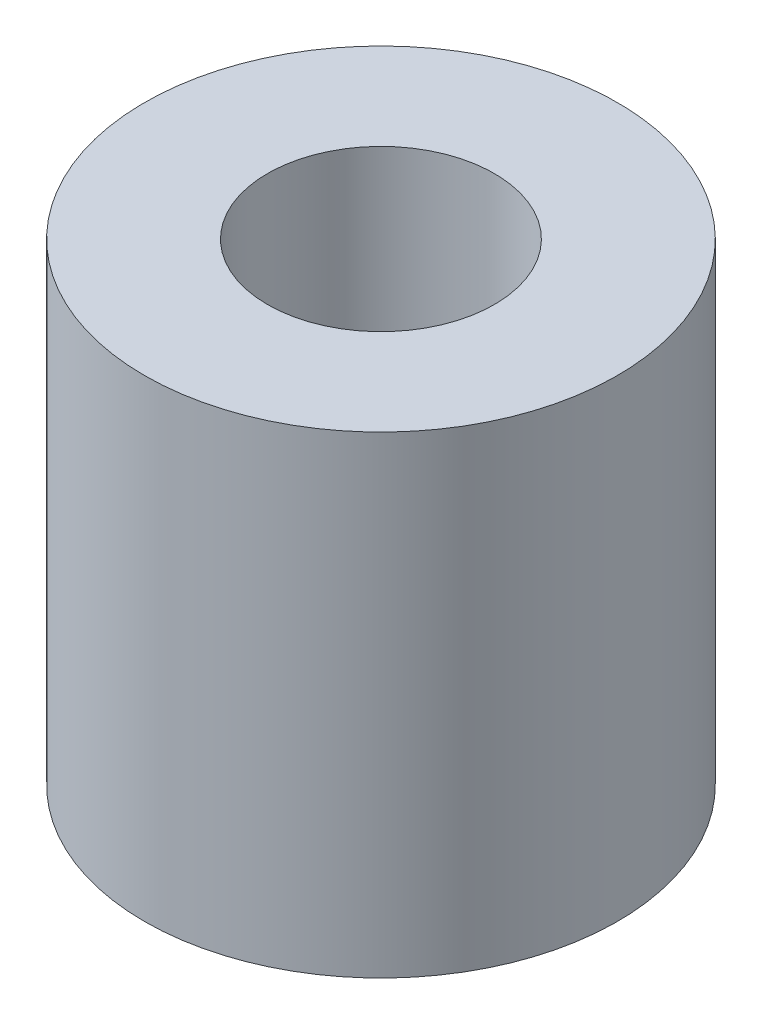
from build123d import *

# Parameters (mm, degrees)
SKETCH1_R           = 3.175
SKETCH1_R_2         = 1.524
BOSS_EXTRUDE1_DEPTH = 6.35


with BuildPart() as part:
    # Sketch1 → Boss-Extrude1 (new body)
    with BuildSketch(Plane(origin=(0, 0, 0), x_dir=(1, 0, 0), z_dir=(0, 1, 0))):
        with Locations(Location((0, 0, 0), (0, 0, 270))):
            Circle(SKETCH1_R)
        with Locations(Location((0, 0, 0), (0, 0, 270))):
            Circle(SKETCH1_R_2, mode=Mode.SUBTRACT)
    extrude(amount=BOSS_EXTRUDE1_DEPTH)


solid = part.part
